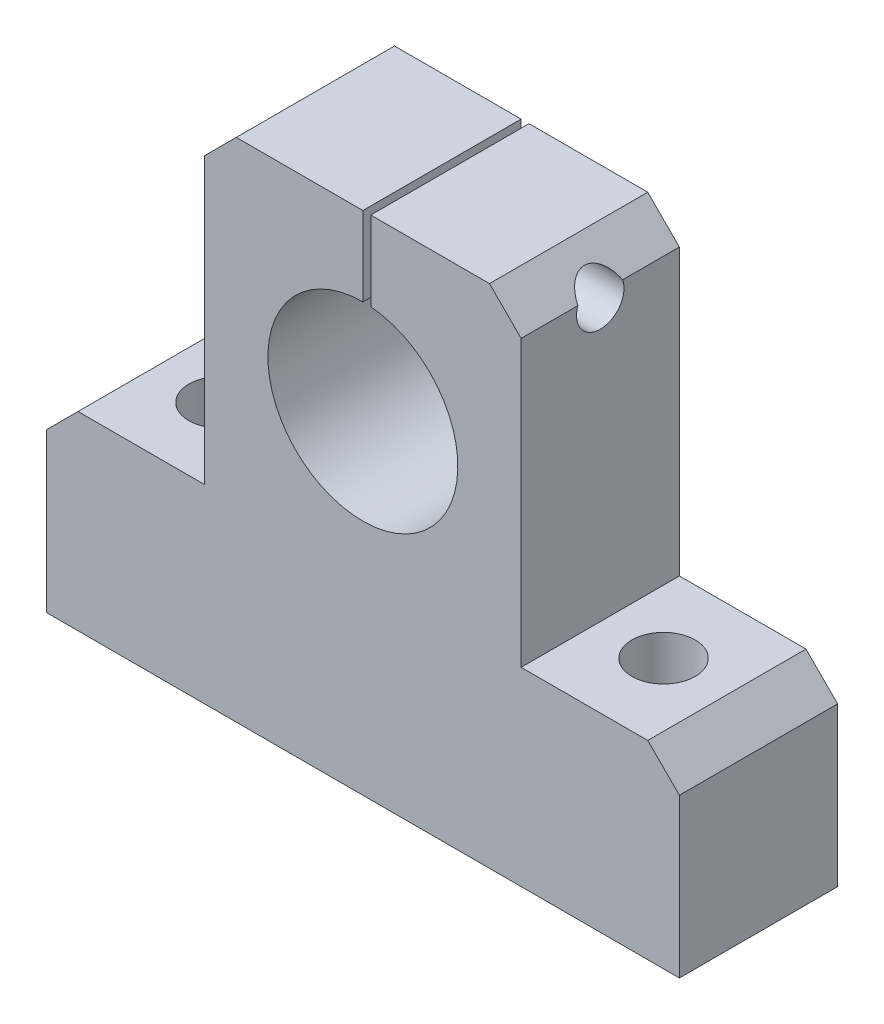
from build123d import *

# Parameters (mm, degrees)
BOSS_EXTRUDE1_DEPTH            = 10
CUT_EXTRUDE1_DEPTH             = 45.988887517
CUT_EXTRUDE1_DEPTH_BACK        = 45.988887517
SKETCH2_R                      = 1.5
CUT_EXTRUDE2_REACH             = 32
SKETCH3_R                      = 2
CUT_EXTRUDE2_DIRECTION_2_DEPTH = 31


with BuildPart() as part:
    # Sketch1 → Boss-Extrude1 (new body)
    with BuildSketch(Plane.XY):
        with BuildLine():
            Line((20, 0), (-20, 0))
            Line((-20, 0), (-20, 10))
            Line((-20, 10), (-18, 12))
            Line((-18, 12), (-10, 12))
            Line((-10, 12), (-10, 30))
            Line((-10, 30), (-8, 32))
            Line((-8, 32), (0, 32))
            Line((0, 32), (0, 27))
            ThreePointArc((0, 27), (-0.250217676, 15.005219678), (0.5, 26.979130372))
            Line((0.5, 26.979130372), (0.5, 32))
            Line((0.5, 32), (8, 32))
            Line((8, 32), (10, 30))
            Line((10, 30), (10, 12))
            Line((10, 12), (18, 12))
            Line((18, 12), (20, 10))
            Line((20, 10), (20, 0))
        make_face()
    extrude(amount=BOSS_EXTRUDE1_DEPTH)

    # Sketch2 → Cut-Extrude1 (cut, two sides: drawn at the far end of the back side and taken through both)
    with BuildSketch(Plane.ZY.offset(10).offset(-CUT_EXTRUDE1_DEPTH_BACK)):
        with Locations(Location((5, 29.5, 0), (0, 0, 270))):
            Circle(SKETCH2_R)
    extrude(amount=CUT_EXTRUDE1_DEPTH + CUT_EXTRUDE1_DEPTH_BACK, mode=Mode.SUBTRACT)

    # Sketch3 → Cut-Extrude2 (cut, up to next)
    with BuildSketch(Plane(origin=(0, 12, 0), x_dir=(1, 0, 0), z_dir=(0, 1, 0)), mode=Mode.PRIVATE) as cut_extrude2_sk1:
        with Locations(Location((14, -5, 0), (0, 0, 180))):
            Circle(SKETCH3_R)
    cut_extrude2_tool1 = extrude(cut_extrude2_sk1.sketch, amount=-CUT_EXTRUDE2_REACH, mode=Mode.PRIVATE) & part.part
    # Sketch3 → Cut-Extrude2 (cut, up to next)
    with BuildSketch(Plane(origin=(0, 12, 0), x_dir=(1, 0, 0), z_dir=(0, 1, 0)), mode=Mode.PRIVATE) as cut_extrude2_sk2:
        with Locations(Location((-14, -5, 0), (0, 0, 180))):
            Circle(SKETCH3_R)
    cut_extrude2_tool2 = extrude(cut_extrude2_sk2.sketch, amount=-CUT_EXTRUDE2_REACH, mode=Mode.PRIVATE) & part.part
    add(cut_extrude2_tool1.solids().sort_by_distance((14, 12, 5))[0], mode=Mode.SUBTRACT)
    add(cut_extrude2_tool2.solids().sort_by_distance((-14, 12, 5))[0], mode=Mode.SUBTRACT)

    # Sketch3 → Cut-Extrude2 direction 2 (cut)
    with BuildSketch(Plane(origin=(0, 12, 0), x_dir=(1, 0, 0), z_dir=(0, 1, 0))):
        with Locations(Location((14, -5, 0), (0, 0, 180))):
            Circle(SKETCH3_R)
        with Locations(Location((-14, -5, 0), (0, 0, 180))):
            Circle(SKETCH3_R)
    extrude(amount=CUT_EXTRUDE2_DIRECTION_2_DEPTH, mode=Mode.SUBTRACT)


solid = part.part
